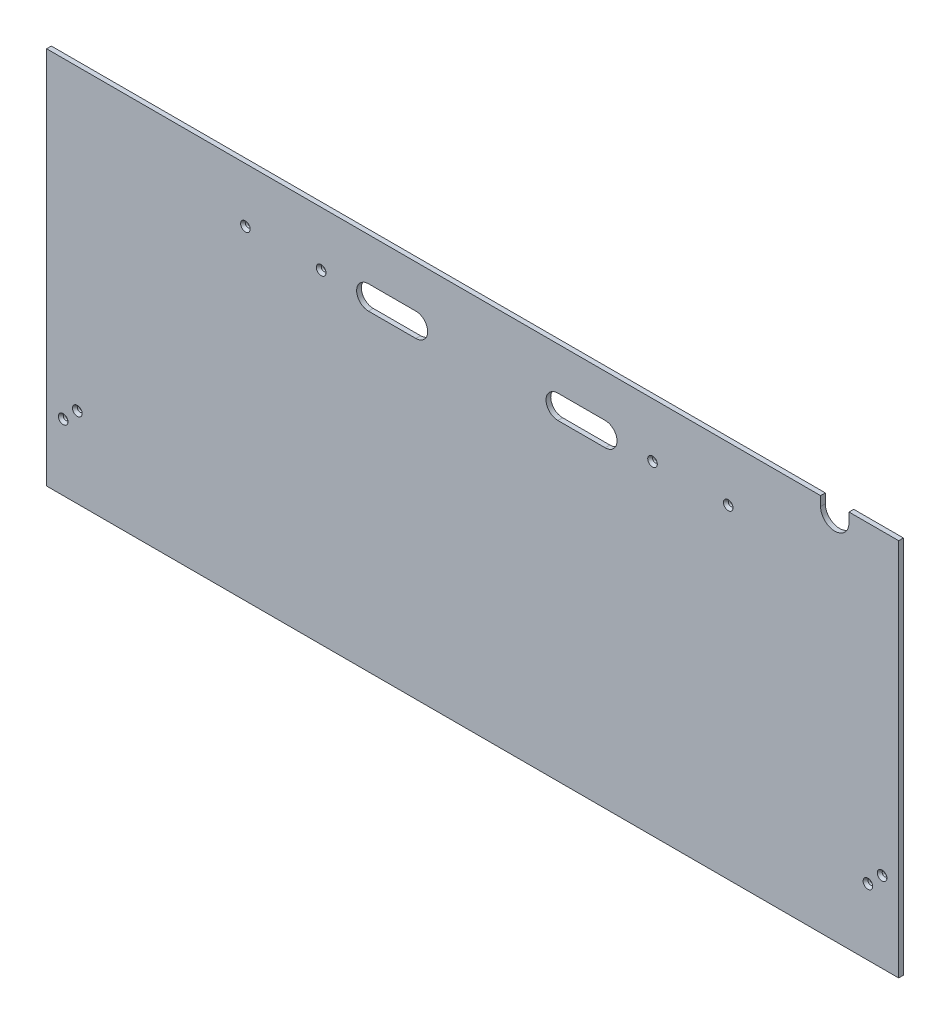
from build123d import *

# Parameters (mm, degrees)
SKETCH1_W                                     = 1143
SKETCH1_H                                     = 508
BOSS_EXTRUDE1_DEPTH                           = 6.35
CUT_EXTRUDE1_DEPTH                            = 1251.821059345
CSK_FOR_1_4_FLAT_HEAD_MACHINE_SCREW1_AT_COUNT = 2
CSK_FOR_1_4_FLAT_HEAD_MACHINE_SCREW1_AT_PITCH = 101.6
CSK_FOR_1_4_FLAT_HEAD_MACHINE_SCREW1_2_COUNT  = 2
CSK_FOR_1_4_FLAT_HEAD_MACHINE_SCREW1_2_PITCH  = 546.1
CSK_FOR_1_4_FLAT_HEAD_MACHINE_SCREW1_3_COUNT  = 2
CSK_FOR_1_4_FLAT_HEAD_MACHINE_SCREW1_3_PITCH  = 647.7
CSK_FOR_1_4_FLAT_HEAD_MACHINE_SCREW1_4_COUNT  = 2
CSK_FOR_1_4_FLAT_HEAD_MACHINE_SCREW1_4_PITCH  = 386.698837922
CSK_FOR_1_4_FLAT_HEAD_MACHINE_SCREW1_5_COUNT  = 2
CSK_FOR_1_4_FLAT_HEAD_MACHINE_SCREW1_5_PITCH  = 393.520725312
CSK_FOR_1_4_FLAT_HEAD_MACHINE_SCREW1_6_COUNT  = 2
CSK_FOR_1_4_FLAT_HEAD_MACHINE_SCREW1_6_PITCH  = 932.358630705
CSK_FOR_1_4_FLAT_HEAD_MACHINE_SCREW1_7_COUNT  = 2
CSK_FOR_1_4_FLAT_HEAD_MACHINE_SCREW1_7_PITCH  = 956.945210683
CUT_EXTRUDE2_DEPTH                            = 1251.821059345


with BuildPart() as part:
    # Sketch1 → Boss-Extrude1 (new body)
    with BuildSketch(Plane.XY):
        with Locations((571.5, 254)):
            Rectangle(SKETCH1_W, SKETCH1_H)
    extrude(amount=BOSS_EXTRUDE1_DEPTH)

    # Sketch2 → Cut-Extrude1 (cut, through all)
    with BuildSketch(Plane.XY.offset(6.35)):
        with BuildLine():
            Line((431.8, 450.85), (495.3, 450.85))
            ThreePointArc((495.3, 450.85), (511.175, 434.975), (495.3, 419.1))
            Line((495.3, 419.1), (431.8, 419.1))
            ThreePointArc((431.8, 419.1), (415.925, 434.975), (431.8, 450.85))
        make_face()
        with BuildLine():
            Line((685.8, 450.85), (749.3, 450.85))
            ThreePointArc((749.3, 450.85), (765.175, 434.975), (749.3, 419.1))
            Line((749.3, 419.1), (685.8, 419.1))
            ThreePointArc((685.8, 419.1), (669.925, 434.975), (685.8, 450.85))
        make_face()
    extrude(amount=-CUT_EXTRUDE1_DEPTH, mode=Mode.SUBTRACT)

    # Sketch5 → CSK for 1/4 Flat Head Machine Screw1 (revolve, cut)
    with BuildSketch(Plane(origin=(914.4, 434.975, 6.35), x_dir=(0, -1, 0), z_dir=(1, 0, 0))):
        Polygon((0, 0), (0, 6.35), (3.3782, 6.35), (3.3782, 3.520932584), (6.4389, 0), align=None)
    csk_for_1_4_flat_head_machine_screw1 = revolve(axis=Axis((914.4, 434.975, 12.7), (0, 0, -1)), mode=Mode.SUBTRACT)

    # CSK for 1/4 Flat Head Machine Screw1 at: CSK for 1/4 Flat Head Machine Screw1 ×2
    with Locations(*[(-i * CSK_FOR_1_4_FLAT_HEAD_MACHINE_SCREW1_AT_PITCH, 0, 0) for i in range(1, CSK_FOR_1_4_FLAT_HEAD_MACHINE_SCREW1_AT_COUNT)]):
        add(csk_for_1_4_flat_head_machine_screw1, mode=Mode.SUBTRACT)

    # CSK for 1_4 Flat Head Machine Screw1 2: CSK for 1/4 Flat Head Machine Screw1 ×2
    with Locations(*[(-i * CSK_FOR_1_4_FLAT_HEAD_MACHINE_SCREW1_2_PITCH, 0, 0) for i in range(1, CSK_FOR_1_4_FLAT_HEAD_MACHINE_SCREW1_2_COUNT)]):
        add(csk_for_1_4_flat_head_machine_screw1, mode=Mode.SUBTRACT)

    # CSK for 1_4 Flat Head Machine Screw1 3: CSK for 1/4 Flat Head Machine Screw1 ×2
    with Locations(*[(-i * CSK_FOR_1_4_FLAT_HEAD_MACHINE_SCREW1_3_PITCH, 0, 0) for i in range(1, CSK_FOR_1_4_FLAT_HEAD_MACHINE_SCREW1_3_COUNT)]):
        add(csk_for_1_4_flat_head_machine_screw1, mode=Mode.SUBTRACT)

    # CSK for 1_4 Flat Head Machine Screw1 4: CSK for 1/4 Flat Head Machine Screw1 ×2
    with Locations(*[Vector(0.5336840449512364, -0.8456839481534971, 0) * (i * CSK_FOR_1_4_FLAT_HEAD_MACHINE_SCREW1_4_PITCH) for i in range(1, CSK_FOR_1_4_FLAT_HEAD_MACHINE_SCREW1_4_COUNT)]):
        add(csk_for_1_4_flat_head_machine_screw1, mode=Mode.SUBTRACT)

    # CSK for 1_4 Flat Head Machine Screw1 5: CSK for 1/4 Flat Head Machine Screw1 ×2
    with Locations(*[Vector(0.4760232128854988, -0.879432715330836, 0) * (i * CSK_FOR_1_4_FLAT_HEAD_MACHINE_SCREW1_5_PITCH) for i in range(1, CSK_FOR_1_4_FLAT_HEAD_MACHINE_SCREW1_5_COUNT)]):
        add(csk_for_1_4_flat_head_machine_screw1, mode=Mode.SUBTRACT)

    # CSK for 1_4 Flat Head Machine Screw1 6: CSK for 1/4 Flat Head Machine Screw1 ×2
    with Locations(*[Vector(-0.936469048760605, -0.3507502255357902, 0) * (i * CSK_FOR_1_4_FLAT_HEAD_MACHINE_SCREW1_6_PITCH) for i in range(1, CSK_FOR_1_4_FLAT_HEAD_MACHINE_SCREW1_6_COUNT)]):
        add(csk_for_1_4_flat_head_machine_screw1, mode=Mode.SUBTRACT)

    # CSK for 1_4 Flat Head Machine Screw1 7: CSK for 1/4 Flat Head Machine Screw1 ×2
    with Locations(*[Vector(-0.9323156540621644, -0.36164557399564384, 0) * (i * CSK_FOR_1_4_FLAT_HEAD_MACHINE_SCREW1_7_PITCH) for i in range(1, CSK_FOR_1_4_FLAT_HEAD_MACHINE_SCREW1_7_COUNT)]):
        add(csk_for_1_4_flat_head_machine_screw1, mode=Mode.SUBTRACT)

    # Sketch6 → Cut-Extrude2 (cut, through all)
    with BuildSketch(Plane.XY.offset(6.35)):
        with BuildLine():
            Line((1038.225, 508), (1076.325, 508))
            Line((1076.325, 508), (1076.325, 495.3))
            ThreePointArc((1076.325, 495.3), (1057.275, 476.25), (1038.225, 495.3))
            Line((1038.225, 495.3), (1038.225, 508))
        make_face()
    extrude(amount=-CUT_EXTRUDE2_DEPTH, mode=Mode.SUBTRACT)


solid = part.part
